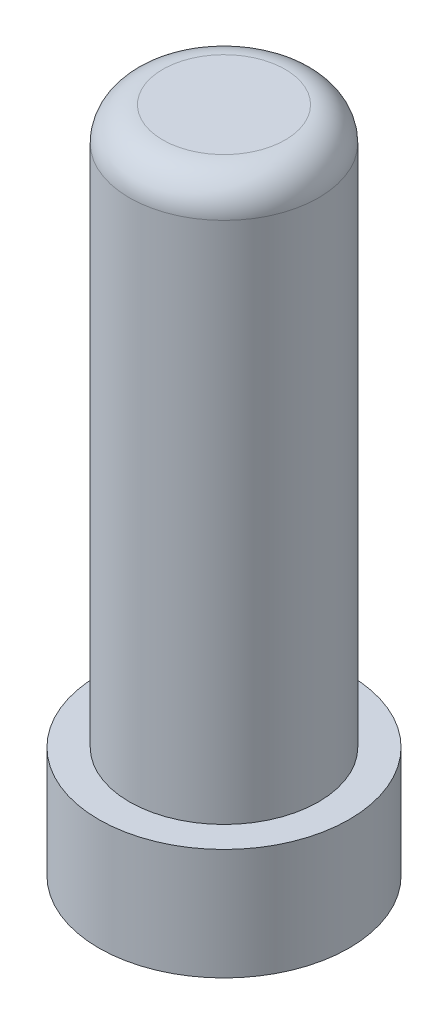
from build123d import *

# Parameters (mm, degrees)
SKETCH_1_R      = 2.25
EXTRUDE_1_DEPTH = 2
SKETCH_2_R      = 1.7
EXTRUDE_2_DEPTH = 10
FILLET_1_R      = 0.6


with BuildPart() as part:
    # 草图1 → 凸台-拉伸1 (new body)
    with BuildSketch(Plane(origin=(0, 0, 0), x_dir=(1, 0, 0), z_dir=(0, 1, 0))):
        with Locations(Location((0, 0, 0), (0, 0, 270))):
            Circle(SKETCH_1_R)
    extrude(amount=EXTRUDE_1_DEPTH)

    # 草图2 → 凸台-拉伸2 (add)
    with BuildSketch(Plane(origin=(0, 2, 0), x_dir=(1, 0, 0), z_dir=(0, 1, 0))):
        with Locations(Location((0, 0, 0), (0, 0, 270))):
            Circle(SKETCH_2_R)
    extrude(amount=EXTRUDE_2_DEPTH)

    # 圆角1
    fillet_1_edges = [part.edges().sort_by_distance(p)[0] for p in [
        (0, 12, -1.7),
    ]]
    fillet(fillet_1_edges, radius=FILLET_1_R)


solid = part.part
